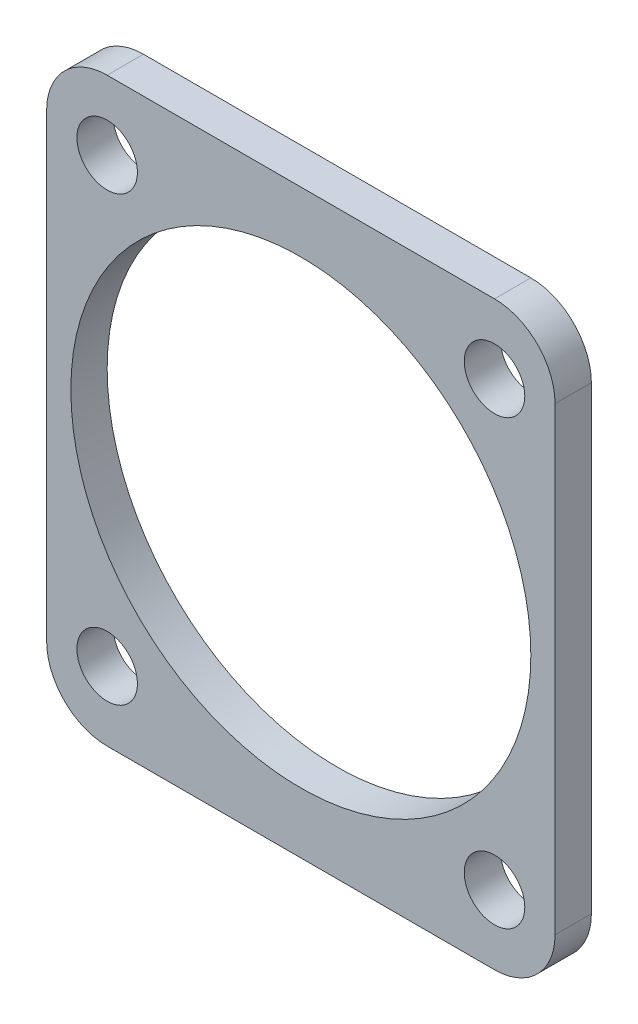
from build123d import *

# Parameters (mm, degrees)
SKETCH1_W           = 42
SKETCH1_H           = 48
SKETCH1_R           = 19
SKETCH1_R_2         = 2.5
BOSS_EXTRUDE1_DEPTH = 3
FILLET1_R           = 5


with BuildPart() as part:
    # Sketch1 → Boss-Extrude1 (new body)
    with BuildSketch(Plane.XY):
        Rectangle(SKETCH1_W, SKETCH1_H)
        Circle(SKETCH1_R, mode=Mode.SUBTRACT)
        with Locations((-16, 18.285714286)):
            Circle(SKETCH1_R_2, mode=Mode.SUBTRACT)
        with Locations((16, 18.285714286)):
            Circle(SKETCH1_R_2, mode=Mode.SUBTRACT)
        with Locations((16, -18.285714286)):
            Circle(SKETCH1_R_2, mode=Mode.SUBTRACT)
        with Locations((-16, -18.285714286)):
            Circle(SKETCH1_R_2, mode=Mode.SUBTRACT)
    extrude(amount=BOSS_EXTRUDE1_DEPTH)

    # Fillet1
    fillet1_edges = [part.edges().sort_by_distance(p)[0] for p in [
        (21, -24, 1.5),
        (-21, -24, 1.5),
        (-21, 24, 1.5),
        (21, 24, 1.5),
    ]]
    fillet(fillet1_edges, radius=FILLET1_R)


solid = part.part
